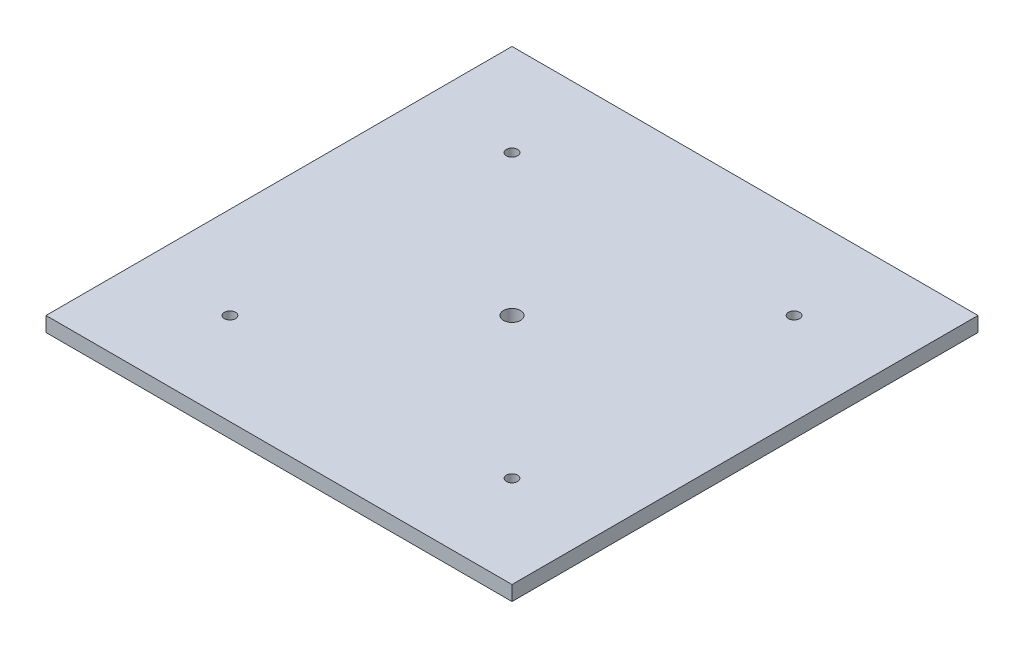
from build123d import *

# Parameters (mm, degrees)
SKETCH1_W            = 200
SKETCH1_H            = 200
BOSS_EXTRUDE1_DEPTH  = 6.35
SKETCH2_R            = 3.675
CUT_EXTRUDE1_DEPTH   = 142.56384602
M4_CLEARANCE_HOLE1_D = 4.8


with BuildPart() as part:
    # Sketch1 → Boss-Extrude1 (new body)
    with BuildSketch(Plane(origin=(0, 0, 0), x_dir=(1, 0, 0), z_dir=(0, 1, 0))):
        Rectangle(SKETCH1_W, SKETCH1_H)
    extrude(amount=BOSS_EXTRUDE1_DEPTH)

    # Sketch2 → Cut-Extrude1 (cut, through all)
    with BuildSketch(Plane(origin=(0, 6.35, 0), x_dir=(1, 0, 0), z_dir=(0, 1, 0))):
        with Locations(Location((0, 0, 0), (0, 0, 270))):
            Circle(SKETCH2_R)
    extrude(amount=-CUT_EXTRUDE1_DEPTH, mode=Mode.SUBTRACT)

    # M4 Clearance Hole1 (through all)
    with Locations(Plane(origin=(-60.53, 6.35, -60.53), x_dir=(0, 0, 1), z_dir=(0, 1, 0))):
        with Locations((0, 0), (0, 121.06), (121.06, 121.06), (121.06, 0)):
            Hole(M4_CLEARANCE_HOLE1_D / 2)


solid = part.part
